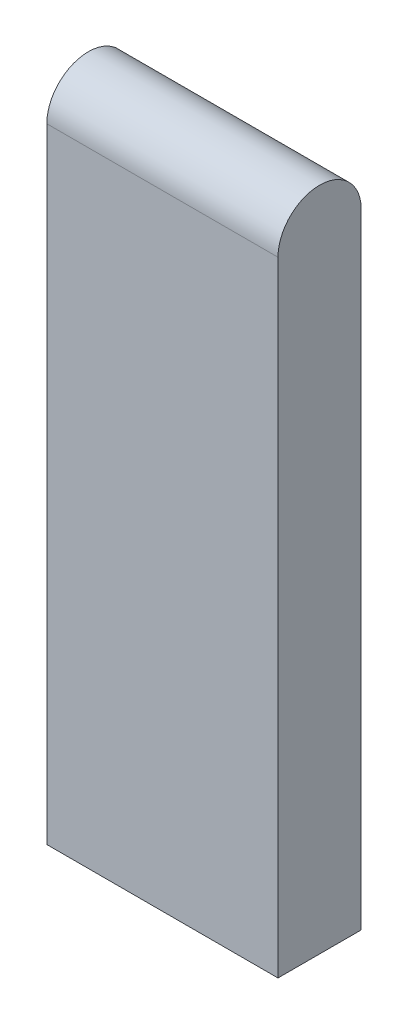
from build123d import *

# Parameters (mm, degrees)
BOSS_EXTRUDE1_DEPTH = 25


with BuildPart() as part:
    # Sketch1 → Boss-Extrude1 (new, symmetric)
    with BuildSketch(Plane(origin=(0, 0, 0), x_dir=(0, 0, -1), z_dir=(1, 0, 0))):
        with BuildLine():
            Line((-9, 67.5), (-9, -67.5))
            Line((-9, -67.5), (9, -67.5))
            Line((9, -67.5), (9, 67.5))
            ThreePointArc((9, 67.5), (0, 76.5), (-9, 67.5))
        make_face()
    extrude(amount=BOSS_EXTRUDE1_DEPTH, both=True)


solid = part.part
